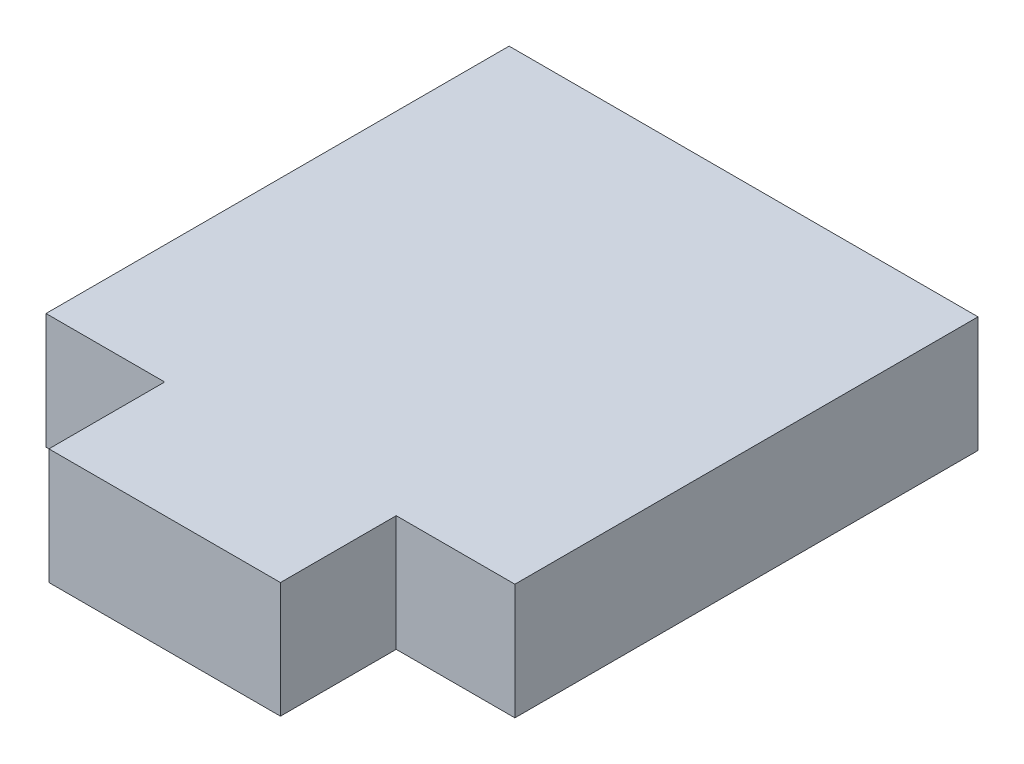
from build123d import *

# Parameters (mm, degrees)
BOSS_EXTRUDE1_DEPTH = 6.35


with BuildPart() as part:
    # Sketch1 → Boss-Extrude1 (new body)
    with BuildSketch(Plane(origin=(0, 0, 0), x_dir=(1, 0, 0), z_dir=(0, 1, 0))):
        Polygon((-25.7175, 25.4), (0, 25.4), (0, 0), (-6.50875, 0), (-6.50875, -6.35), (-19.20875, -6.35), (-19.20875, 0), (-25.7175, 0), align=None)
    extrude(amount=BOSS_EXTRUDE1_DEPTH)


solid = part.part
